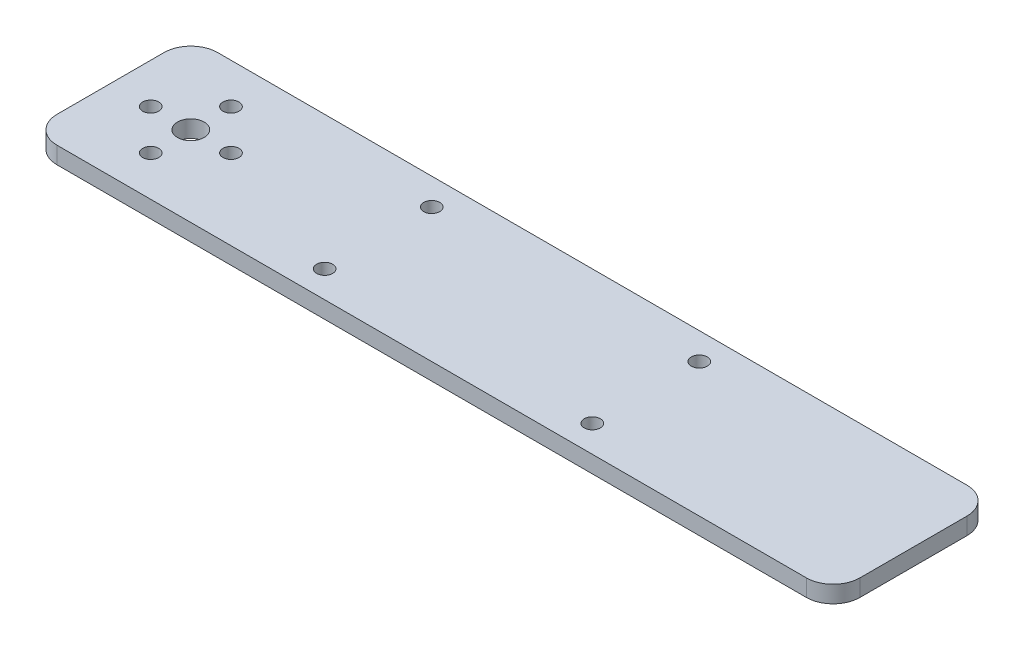
from build123d import *

# Parameters (mm, degrees)
SKETCH1_W           = 150
SKETCH1_H           = 30
BOSS_EXTRUDE1_DEPTH = 3.175
FILLET1_R           = 5
SKETCH2_R           = 2.5
CUT_EXTRUDE1_DEPTH  = 136.867879298
SKETCH3_R           = 1.5
CUT_EXTRUDE3_DEPTH  = 136.867879298
SKETCH4_R           = 1.5
CUT_EXTRUDE4_DEPTH  = 10


with BuildPart() as part:
    # Sketch1 → Boss-Extrude1 (new body)
    with BuildSketch(Plane(origin=(0, 0, 0), x_dir=(1, 0, 0), z_dir=(0, 1, 0))):
        with Locations((60, 0)):
            Rectangle(SKETCH1_W, SKETCH1_H)
    extrude(amount=BOSS_EXTRUDE1_DEPTH)

    # Fillet1
    fillet1_edges = [part.edges().sort_by_distance(p)[0] for p in [
        (-15, 1.5875, -15),
        (135, 1.5875, -15),
        (135, 1.5875, 15),
        (-15, 1.5875, 15),
    ]]
    fillet(fillet1_edges, radius=FILLET1_R)

    # Sketch2 → Cut-Extrude1 (cut, through all)
    with BuildSketch(Plane(origin=(0, 3.175, 0), x_dir=(1, 0, 0), z_dir=(0, 1, 0))):
        with Locations(Location((0, 0, 0), (0, 0, 270))):
            Circle(SKETCH2_R)
    extrude(amount=-CUT_EXTRUDE1_DEPTH, mode=Mode.SUBTRACT)

    # Sketch3 → Cut-Extrude3 (cut, through all)
    with BuildSketch(Plane(origin=(0, 3.175, 0), x_dir=(1, 0, 0), z_dir=(0, 1, 0))):
        with Locations(Location((7.5, 0, 0), (0, 0, 270))):
            Circle(SKETCH3_R)
        with Locations(Location((0, -7.5, 0), (0, 0, 270))):
            Circle(SKETCH3_R)
        with Locations(Location((-7.5, 0, 0), (0, 0, 270))):
            Circle(SKETCH3_R)
        with Locations(Location((0, 7.5, 0), (0, 0, 270))):
            Circle(SKETCH3_R)
    extrude(amount=-CUT_EXTRUDE3_DEPTH, mode=Mode.SUBTRACT)

    # Sketch4 → Cut-Extrude4 (cut)
    with BuildSketch(Plane(origin=(0, 3.175, 0), x_dir=(1, 0, 0), z_dir=(0, 1, 0))):
        with Locations(Location((35, -10, 0), (0, 0, 270))):
            Circle(SKETCH4_R)
        with Locations(Location((85, -10, 0), (0, 0, 270))):
            Circle(SKETCH4_R)
        with Locations(Location((85, 10, 0), (0, 0, 270))):
            Circle(SKETCH4_R)
        with Locations(Location((35, 10, 0), (0, 0, 270))):
            Circle(SKETCH4_R)
    extrude(amount=-CUT_EXTRUDE4_DEPTH, mode=Mode.SUBTRACT)


solid = part.part
